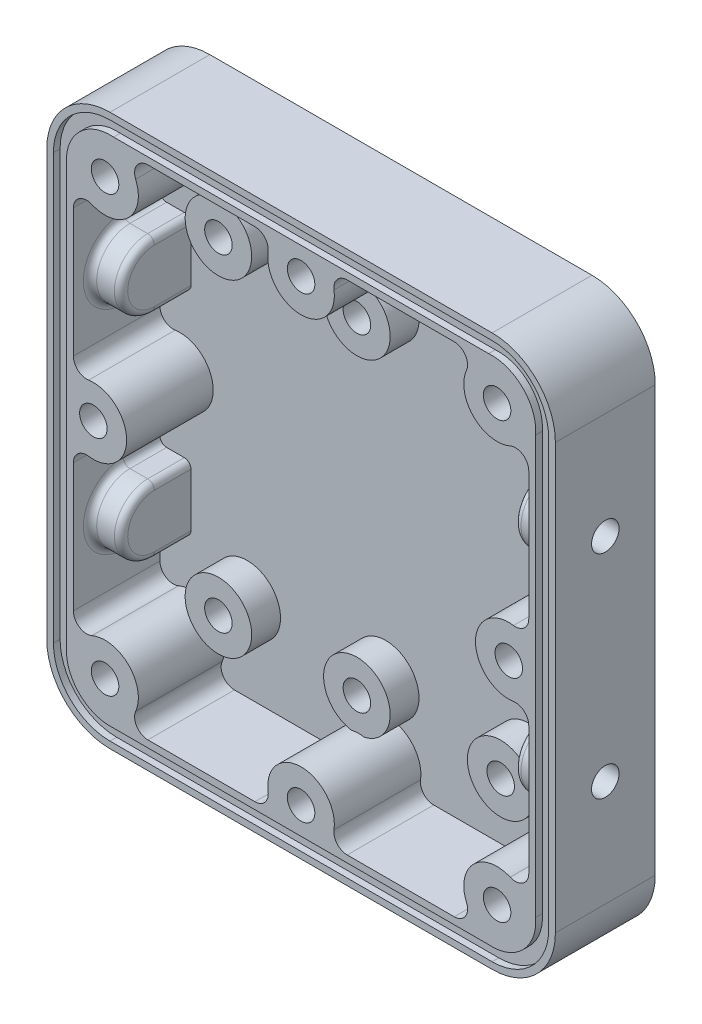
from build123d import *

# Parameters (mm, degrees)
BOSS_EXTRUDE1_DEPTH = 16.51
SHELL1_T            = 2.54
CUT_EXTRUDE1_START  = -1.27
CUT_EXTRUDE1_DEPTH  = 1.27
BOSS_EXTRUDE2_DEPTH = 15.24
BOSS_EXTRUDE3_DEPTH = 16.51
BOSS_EXTRUDE4_DEPTH = 16.51
SKETCH9_R           = 2.625
SKETCH9_R_2         = 2.622850359
CUT_EXTRUDE2_DEPTH  = 10
FILLET1_R           = 2.54
SKETCH10_R          = 6.35
SKETCH10_R_2        = 2.625
BOSS_EXTRUDE5_DEPTH = 5.499999922
BOSS_EXTRUDE6_DEPTH = 11
SKETCH13_R          = 2.625
CUT_EXTRUDE3_DEPTH  = 8
FILLET2_R           = 1.27


with BuildPart() as part:
    # Sketch2 → Boss-Extrude1 (new body)
    with BuildSketch(Plane.XY):
        with BuildLine():
            Line((15.620999985, 153.923994751), (88.518997498, 153.923994751))
            ThreePointArc((88.518997498, 153.923994751), (95.254189588, 151.134186842), (98.043997498, 144.398994751))
            Line((98.043997498, 144.398994751), (98.043997498, 63.373000793))
            ThreePointArc((98.043997498, 63.373000793), (95.254189588, 56.637808703), (88.518997498, 53.848000793))
            Line((88.518997498, 53.848000793), (15.620999985, 53.848000793))
            ThreePointArc((15.620999985, 53.848000793), (8.885807894, 56.637808703), (6.095999985, 63.373000793))
            Line((6.095999985, 63.373000793), (6.095999985, 144.398994751))
            ThreePointArc((6.095999985, 144.398994751), (8.885807894, 151.134186842), (15.620999985, 153.923994751))
        make_face()
    extrude(amount=BOSS_EXTRUDE1_DEPTH)

    # Shell1
    shell1_openings = [part.faces().sort_by_distance(p)[0] for p in [
        (52.069998741, 103.885997772, 16.51),
    ]]
    offset(amount=SHELL1_T, openings=shell1_openings, kind=Kind.INTERSECTION)

    # Sketch4 → Cut-Extrude1 (cut)
    with BuildSketch(Plane.XY.offset(16.51).offset(CUT_EXTRUDE1_START)):
        with BuildLine():
            Line((88.518997498, 155.193994751), (15.620999985, 155.193994751))
            ThreePointArc((15.620999985, 155.193994751), (7.987782282, 152.032212454), (4.825999985, 144.398994751))
            Line((4.825999985, 144.398994751), (4.825999985, 63.373000793))
            ThreePointArc((4.825999985, 63.373000793), (7.987782282, 55.739783091), (15.620999985, 52.578000793))
            Line((15.620999985, 52.578000793), (88.518997498, 52.578000793))
            ThreePointArc((88.518997498, 52.578000793), (96.1522152, 55.739783091), (99.313997498, 63.373000793))
            Line((99.313997498, 63.373000793), (99.313997498, 144.398994751))
            ThreePointArc((99.313997498, 144.398994751), (96.1522152, 152.032212454), (88.518997498, 155.193994751))
        make_face()
        with BuildLine():
            Line((88.518997498, 153.923994751), (15.620999985, 153.923994751))
            ThreePointArc((15.620999985, 153.923994751), (8.885807894, 151.134186842), (6.095999985, 144.398994751))
            Line((6.095999985, 144.398994751), (6.095999985, 63.373000793))
            ThreePointArc((6.095999985, 63.373000793), (8.885807894, 56.637808703), (15.620999985, 53.848000793))
            Line((15.620999985, 53.848000793), (88.518997498, 53.848000793))
            ThreePointArc((88.518997498, 53.848000793), (95.254189588, 56.637808703), (98.043997498, 63.373000793))
            Line((98.043997498, 63.373000793), (98.043997498, 144.398994751))
            ThreePointArc((98.043997498, 144.398994751), (95.254189588, 151.134186842), (88.518997498, 153.923994751))
        make_face(mode=Mode.SUBTRACT)
    extrude(amount=CUT_EXTRUDE1_DEPTH, mode=Mode.SUBTRACT)

    # Sketch5 → Boss-Extrude2 (add)
    with BuildSketch(Plane.XY):
        with BuildLine():
            Line((98.043997498, 63.373000793), (98.043997498, 144.398994751))
            ThreePointArc((98.043997498, 144.398994751), (95.254189588, 151.134186842), (88.518997498, 153.923994751))
            Line((88.518997498, 153.923994751), (15.620999985, 153.923994751))
            ThreePointArc((15.620999985, 153.923994751), (8.885807894, 151.134186842), (6.095999985, 144.398994751))
            Line((6.095999985, 144.398994751), (6.095999985, 63.373000793))
            ThreePointArc((6.095999985, 63.373000793), (8.885807894, 56.637808703), (15.620999985, 53.848000793))
            Line((15.620999985, 53.848000793), (88.518997498, 53.848000793))
            ThreePointArc((88.518997498, 53.848000793), (95.254189588, 56.637808703), (98.043997498, 63.373000793))
        make_face()
        with BuildLine():
            Line((7.315199985, 144.398994751), (7.315199985, 63.373000793))
            ThreePointArc((7.315199985, 63.373000793), (9.747912482, 57.49991329), (15.620999985, 55.067200793))
            Line((15.620999985, 55.067200793), (88.518997498, 55.067200793))
            ThreePointArc((88.518997498, 55.067200793), (94.392085001, 57.49991329), (96.824797498, 63.373000793))
            Line((96.824797498, 63.373000793), (96.824797498, 144.398994751))
            ThreePointArc((96.824797498, 144.398994751), (94.392085001, 150.272082254), (88.518997498, 152.704794751))
            Line((88.518997498, 152.704794751), (15.620999985, 152.704794751))
            ThreePointArc((15.620999985, 152.704794751), (9.747912482, 150.272082254), (7.315199985, 144.398994751))
        make_face(mode=Mode.SUBTRACT)
    extrude(amount=BOSS_EXTRUDE2_DEPTH)

    # Sketch7 → Boss-Extrude3 (add)
    with BuildSketch(Plane.XY):
        with BuildLine():
            Line((19.167974373, 149.832276484), (16.295456106, 152.704794751))
            ThreePointArc((16.295456106, 152.704794751), (9.747912482, 150.272082254), (7.315199985, 143.72453863))
            Line((7.315199985, 143.72453863), (10.187718252, 140.852020363))
            ThreePointArc((10.187718252, 140.852020363), (19.167974373, 140.852020363), (19.167974373, 149.832276484))
        make_face()
        with BuildLine():
            Line((93.952279231, 140.852020363), (96.824797498, 143.72453863))
            ThreePointArc((96.824797498, 143.72453863), (94.392085001, 150.272082254), (87.844541376, 152.704794751))
            Line((87.844541376, 152.704794751), (84.97202311, 149.832276484))
            ThreePointArc((84.97202311, 149.832276484), (84.97202311, 140.852020363), (93.952279231, 140.852020363))
        make_face()
        with BuildLine():
            Line((84.97202311, 57.93971906), (87.844541376, 55.067200793))
            ThreePointArc((87.844541376, 55.067200793), (94.392085001, 57.49991329), (96.824797498, 64.047456915))
            Line((96.824797498, 64.047456915), (93.952279231, 66.919975181))
            ThreePointArc((93.952279231, 66.919975181), (84.97202311, 66.919975181), (84.97202311, 57.93971906))
        make_face()
        with BuildLine():
            Line((10.187718252, 66.919975181), (7.315199985, 64.047456915))
            ThreePointArc((7.315199985, 64.047456915), (9.747912482, 57.49991329), (16.295456106, 55.067200793))
            Line((16.295456106, 55.067200793), (19.167974373, 57.93971906))
            ThreePointArc((19.167974373, 57.93971906), (19.167974373, 66.919975181), (10.187718252, 66.919975181))
        make_face()
        with BuildLine():
            Line((48.328689965, 152.704794751), (55.811307518, 152.704794751))
            ThreePointArc((55.811307518, 152.704794751), (52.069998741, 141.223994751), (48.328689965, 152.704794751))
        make_face()
        with BuildLine():
            Line((96.824797498, 107.627306549), (96.824797498, 100.144688996))
            ThreePointArc((96.824797498, 100.144688996), (85.343997498, 103.885997772), (96.824797498, 107.627306549))
        make_face()
        with BuildLine():
            Line((48.328689965, 55.067200793), (55.811307518, 55.067200793))
            ThreePointArc((55.811307518, 55.067200793), (52.069998741, 66.548000793), (48.328689965, 55.067200793))
        make_face()
        with BuildLine():
            Line((7.315199985, 107.627306549), (7.315199985, 100.144688996))
            ThreePointArc((7.315199985, 100.144688996), (18.795999985, 103.885997772), (7.315199985, 107.627306549))
        make_face()
    extrude(amount=BOSS_EXTRUDE3_DEPTH)

    # Sketch8 → Boss-Extrude4 (add)
    with BuildSketch(Plane.XY):
        with BuildLine():
            Line((96.824797498, 63.373000793), (96.824797498, 144.398994751))
            ThreePointArc((96.824797498, 144.398994751), (94.392085001, 150.272082254), (88.518997498, 152.704794751))
            Line((88.518997498, 152.704794751), (15.620999985, 152.704794751))
            ThreePointArc((15.620999985, 152.704794751), (9.747912482, 150.272082254), (7.315199985, 144.398994751))
            Line((7.315199985, 144.398994751), (7.315199985, 63.373000793))
            ThreePointArc((7.315199985, 63.373000793), (9.747912482, 57.49991329), (15.620999985, 55.067200793))
            Line((15.620999985, 55.067200793), (88.518997498, 55.067200793))
            ThreePointArc((88.518997498, 55.067200793), (94.392085001, 57.49991329), (96.824797498, 63.373000793))
        make_face()
        with BuildLine():
            Line((95.503997498, 63.373000793), (95.503997498, 144.398994751))
            ThreePointArc((95.503997498, 144.398994751), (93.458138364, 149.338135618), (88.518997498, 151.383994751))
            Line((88.518997498, 151.383994751), (15.620999985, 151.383994751))
            ThreePointArc((15.620999985, 151.383994751), (10.681859118, 149.338135618), (8.635999985, 144.398994751))
            Line((8.635999985, 144.398994751), (8.635999985, 63.373000793))
            ThreePointArc((8.635999985, 63.373000793), (10.681859118, 58.433859927), (15.620999985, 56.388000793))
            Line((15.620999985, 56.388000793), (88.518997498, 56.388000793))
            ThreePointArc((88.518997498, 56.388000793), (93.458138364, 58.433859927), (95.503997498, 63.373000793))
        make_face(mode=Mode.SUBTRACT)
    extrude(amount=BOSS_EXTRUDE4_DEPTH)

    # Sketch9 → Cut-Extrude2 (cut)
    with BuildSketch(Plane.XY.offset(16.51)):
        with Locations((14.677846312, 145.342148424)):
            Circle(SKETCH9_R)
        with Locations((52.069998741, 147.573994751)):
            Circle(SKETCH9_R)
        with Locations((89.46215117, 145.342148424)):
            Circle(SKETCH9_R)
        with Locations((91.693997498, 103.885997772)):
            Circle(SKETCH9_R_2)
        with Locations((12.445999985, 103.885997772)):
            Circle(SKETCH9_R)
        with Locations((14.677846312, 62.429847121)):
            Circle(SKETCH9_R)
        with Locations((52.069998741, 60.198000793)):
            Circle(SKETCH9_R)
        with Locations((89.46215117, 62.429847121)):
            Circle(SKETCH9_R)
    extrude(amount=-CUT_EXTRUDE2_DEPTH, mode=Mode.SUBTRACT)

    # Fillet1
    fillet1_edges = [part.edges().sort_by_distance(p)[0] for p in [
        (8.635999985, 98.805997772, 8.255),
        (8.635999985, 108.965997772, 8.255),
        (8.635999985, 65.368256915, 8.255),
        (17.616256106, 56.388000793, 8.255),
        (57.149998741, 56.388000793, 8.255),
        (46.989998741, 56.388000793, 8.255),
        (86.523741376, 56.388000793, 8.255),
        (95.503997498, 65.368256915, 8.255),
        (95.503997498, 108.965997772, 8.255),
        (95.503997498, 98.805997772, 8.255),
        (95.503997498, 142.40373863, 8.255),
        (86.523741376, 151.383994751, 8.255),
        (46.989998741, 151.383994751, 8.255),
        (57.149998741, 151.383994751, 8.255),
        (17.616256106, 151.383994751, 8.255),
        (8.635999985, 142.40373863, 8.255),
    ]]
    fillet(fillet1_edges, radius=FILLET1_R)

    # Sketch10 → Boss-Extrude5 (add)
    # profile 1 of 6: a face of its own
    with BuildSketch(Plane.XY):
        with Locations(Location((25.292, 135.128, 0), (0, 0, 180))):
            Circle(SKETCH10_R)
        with Locations((25.292, 135.128)):
            Circle(SKETCH10_R_2, mode=Mode.SUBTRACT)
    # profile 2 of 6: a face of its own
    with BuildSketch(Plane.XY):
        with Locations((51.708, 135.128)):
            Circle(SKETCH10_R)
        with Locations((51.708, 135.128)):
            Circle(SKETCH10_R_2, mode=Mode.SUBTRACT)
    # profile 3 of 6: a face of its own
    with BuildSketch(Plane.XY):
        with Locations(Location((79.14, 135.128, 0), (0, 0, 180))):
            Circle(SKETCH10_R)
        with Locations((79.14, 135.128)):
            Circle(SKETCH10_R_2, mode=Mode.SUBTRACT)
    # profile 4 of 6: a face of its own
    with BuildSketch(Plane.XY):
        with Locations(Location((79.14, 72.644, 0), (0, 0, 180))):
            Circle(SKETCH10_R)
        with Locations((79.14, 72.644)):
            Circle(SKETCH10_R_2, mode=Mode.SUBTRACT)
    # profile 5 of 6: a face of its own
    with BuildSketch(Plane.XY):
        with Locations((51.708, 72.644)):
            Circle(SKETCH10_R)
        with Locations((51.708, 72.644)):
            Circle(SKETCH10_R_2, mode=Mode.SUBTRACT)
    # profile 6 of 6: a face of its own
    with BuildSketch(Plane.XY):
        with Locations(Location((25.292, 72.644, 0), (0, 0, 180))):
            Circle(SKETCH10_R)
        with Locations((25.292, 72.644)):
            Circle(SKETCH10_R_2, mode=Mode.SUBTRACT)
    extrude(amount=BOSS_EXTRUDE5_DEPTH)

    # Sketch12 → Boss-Extrude6 (add)
    with BuildSketch(Plane.ZY.offset(-3.555999985)):
        with BuildLine():
            Line((6.985, 130.492496262), (-2.54, 130.492496262))
            Line((-2.54, 130.492496262), (-2.54, 117.792496262))
            Line((-2.54, 117.792496262), (6.985, 117.792496262))
            ThreePointArc((6.985, 117.792496262), (13.335, 124.142496262), (6.985, 130.492496262))
        make_face()
        with BuildLine():
            Line((6.985, 89.979499283), (-2.54, 89.979499283))
            Line((-2.54, 89.979499283), (-2.54, 77.279499283))
            Line((-2.54, 77.279499283), (6.985, 77.279499283))
            ThreePointArc((6.985, 77.279499283), (13.335, 83.629499283), (6.985, 89.979499283))
        make_face()
    boss_extrude6 = extrude(amount=-BOSS_EXTRUDE6_DEPTH)

    # Sketch13 → Cut-Extrude3 (cut)
    with BuildSketch(Plane.ZY.offset(-3.555999985)):
        with Locations((6.985, 124.142496262)):
            Circle(SKETCH13_R)
        with Locations((6.985, 83.629499283)):
            Circle(SKETCH13_R)
    cut_extrude3 = extrude(amount=-CUT_EXTRUDE3_DEPTH, mode=Mode.SUBTRACT)

    # Mirror1: Boss-Extrude6, Cut-Extrude3 across plane
    add(boss_extrude6.mirror(Plane(origin=(52.069998741, 0, 0), x_dir=(0, 0, 1), z_dir=(1, 0, 0))))
    add(cut_extrude3.mirror(Plane(origin=(52.069998741, 0, 0), x_dir=(0, 0, 1), z_dir=(1, 0, 0))), mode=Mode.SUBTRACT)

    # Fillet2
    fillet2_edges = [part.edges().sort_by_distance(p)[0] for p in [
        (8.635999985, 130.492496262, 3.4925),
        (8.635999985, 124.142496262, 13.335),
        (8.635999985, 117.792496262, 3.4925),
        (14.555999985, 117.792496262, 3.4925),
        (14.555999985, 130.492496262, 3.4925),
        (14.555999985, 124.142496262, 13.335),
        (8.635999985, 89.979499283, 3.4925),
        (8.635999985, 83.629499283, 13.335),
        (8.635999985, 77.279499283, 3.4925),
        (14.555999985, 77.279499283, 3.4925),
        (14.555999985, 89.979499283, 3.4925),
        (14.555999985, 83.629499283, 13.335),
        (95.503997498, 117.792496262, 3.4925),
        (95.503997498, 124.142496262, 13.335),
        (95.503997498, 130.492496262, 3.4925),
        (89.583997498, 130.492496262, 3.4925),
        (89.583997498, 117.792496262, 3.4925),
        (89.583997498, 124.142496262, 13.335),
        (95.503997498, 77.279499283, 3.4925),
        (95.503997498, 83.629499283, 13.335),
        (95.503997498, 89.979499283, 3.4925),
        (89.583997498, 89.979499283, 3.4925),
        (89.583997498, 77.279499283, 3.4925),
        (89.583997498, 83.629499283, 13.335),
    ]]
    fillet(fillet2_edges, radius=FILLET2_R)


solid = part.part
